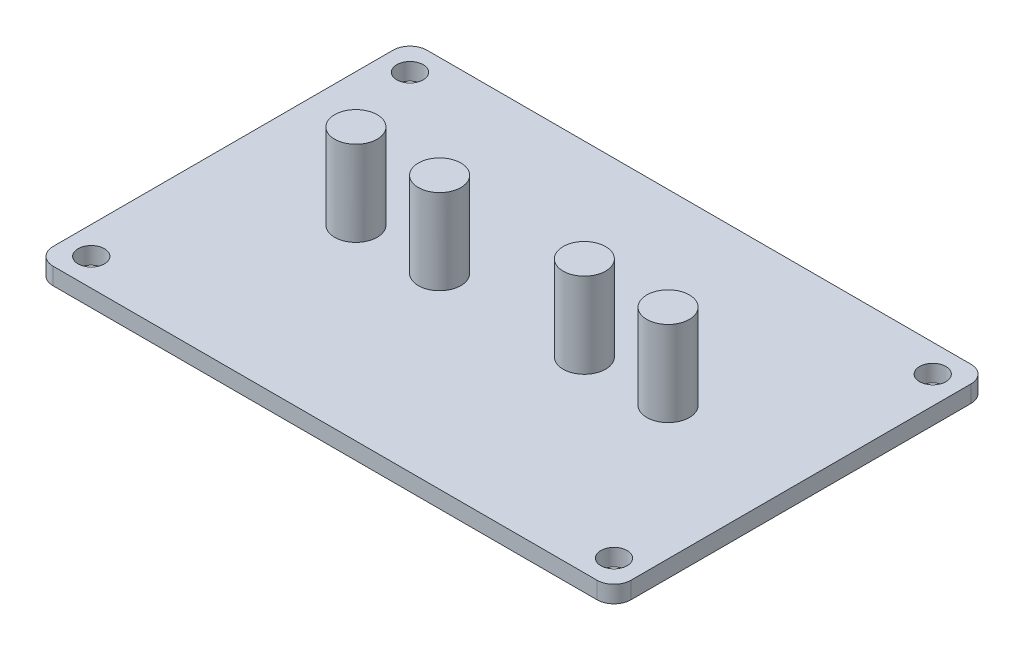
from build123d import *

# Parameters (mm, degrees)
SKETCH_1_W          = 68
SKETCH_1_H          = 44
EXTRUDE_1_DEPTH     = 2
SKETCH_2_R          = 2.5
EXTRUDE_2_DEPTH     = 10
SKETCH_4_R          = 1.55
CUT_EXTRUDE_1_DEPTH = 42.713307229
FILLET_1_R          = 2


with BuildPart() as part:
    # 草图1 → 凸台-拉伸1 (new body)
    with BuildSketch(Plane(origin=(0, 0, 0), x_dir=(1, 0, 0), z_dir=(0, 1, 0))):
        Rectangle(SKETCH_1_W, SKETCH_1_H)
    extrude(amount=EXTRUDE_1_DEPTH)

    # 草图2 → 凸台-拉伸2 (add)
    with BuildSketch(Plane(origin=(0, 2, 0), x_dir=(1, 0, 0), z_dir=(0, 1, 0))):
        with Locations(Location((-18.362121931, 0, 0), (0, 0, 90))):
            Circle(SKETCH_2_R)
        with Locations(Location((-8.514245581, 0, 0), (0, 0, 90))):
            Circle(SKETCH_2_R)
        with Locations(Location((8.514245581, 0, 0), (0, 0, 90))):
            Circle(SKETCH_2_R)
        with Locations(Location((18.362121931, 0, 0), (0, 0, 90))):
            Circle(SKETCH_2_R)
    extrude(amount=EXTRUDE_2_DEPTH)

    # 草图4 → 切除-拉伸1 (cut, through all)
    with BuildSketch(Plane(origin=(0, 2, 0), x_dir=(1, 0, 0), z_dir=(0, 1, 0))):
        with Locations(Location((-30.75, 18.75, 0), (0, 0, 270))):
            Circle(SKETCH_4_R)
        with Locations(Location((-30.75, -18.75, 0), (0, 0, 90))):
            Circle(SKETCH_4_R)
        with Locations(Location((30.75, -18.75, 0), (0, 0, 270))):
            Circle(SKETCH_4_R)
        with Locations(Location((30.75, 18.75, 0), (0, 0, 90))):
            Circle(SKETCH_4_R)
    extrude(amount=-CUT_EXTRUDE_1_DEPTH, mode=Mode.SUBTRACT)

    # 圆角1
    fillet_1_edges = [part.edges().sort_by_distance(p)[0] for p in [
        (34, 1, 22),
        (-34, 1, 22),
        (-34, 1, -22),
        (34, 1, -22),
    ]]
    fillet(fillet_1_edges, radius=FILLET_1_R)


solid = part.part
